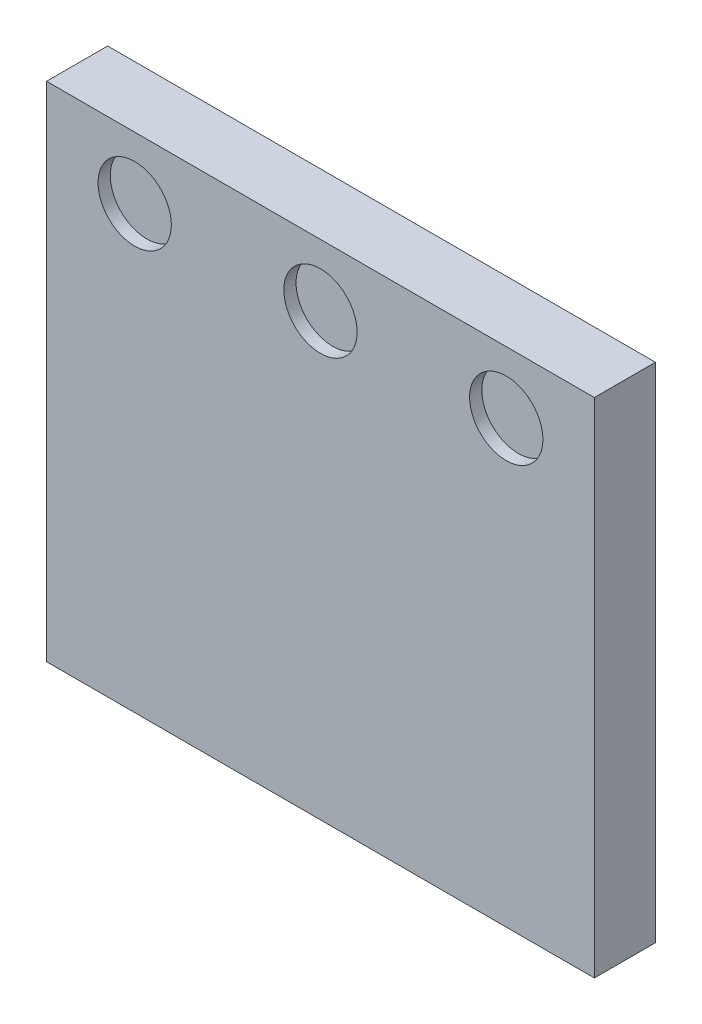
from build123d import *

# Parameters (mm, degrees)
SKETCH_1_W          = 89.675670072
SKETCH_1_H          = 82.296703234
EXTRUDE_1_DEPTH     = 10
SKETCH_3_R          = 6
CUT_EXTRUDE_1_DEPTH = 2
SKETCH_4_R          = 6
CUT_EXTRUDE_2_DEPTH = 2


with BuildPart() as part:
    # 草图1 → 凸台-拉伸1 (new body)
    with BuildSketch(Plane.XY):
        Rectangle(SKETCH_1_W, SKETCH_1_H)
    extrude(amount=EXTRUDE_1_DEPTH)

    # 草图3 → 切除-拉伸1 (cut)
    with BuildSketch(Plane.XY.offset(10)):
        with Locations((-30.411848961, 30.989289131)):
            Circle(SKETCH_3_R)
        with Locations((30.411848961, 30.989289131)):
            Circle(SKETCH_3_R)
    extrude(amount=-CUT_EXTRUDE_1_DEPTH, mode=Mode.SUBTRACT)

    # 草图4 → 切除-拉伸2 (cut)
    with BuildSketch(Plane.XY.offset(10)):
        with Locations((0, 30.989289131)):
            Circle(SKETCH_4_R)
    extrude(amount=-CUT_EXTRUDE_2_DEPTH, mode=Mode.SUBTRACT)


solid = part.part
